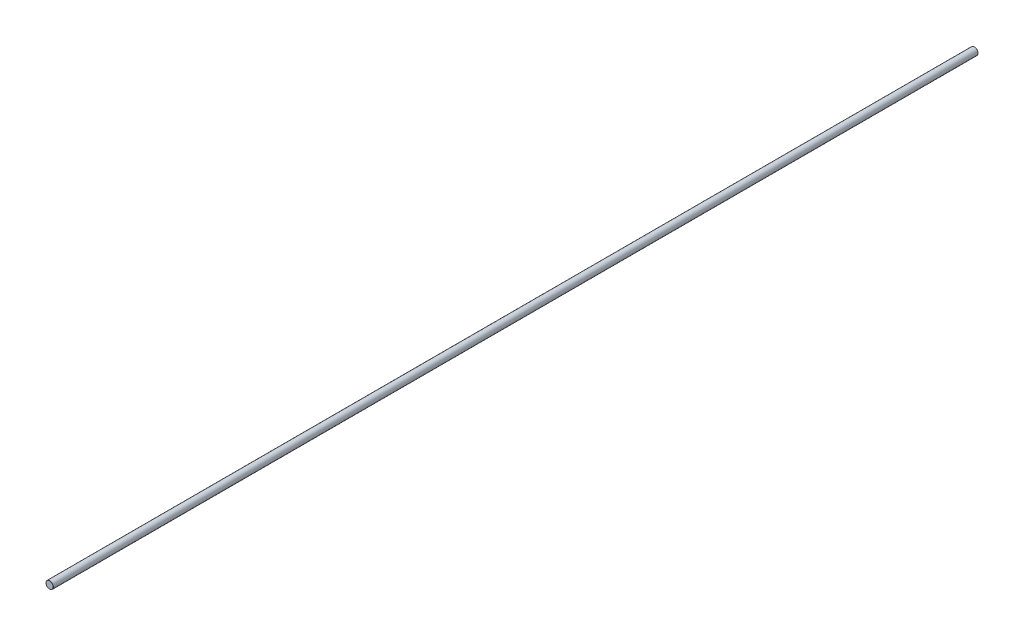
from build123d import *

# Parameters (mm, degrees)
BOSS_EXTRUDE1_DEPTH      = 750
BOSS_EXTRUDE1_DEPTH_BACK = 750
SKETCH3_R                = 6
CHAMFER1_SIZE            = 0.24
SKETCH5_R                = 0.04114626
CUT_EXTRUDE2_DEPTH       = 751.047998464


with BuildPart() as part:
    # Sketch3 → Boss-Extrude1 (new, two sides: drawn at the far end of the back side and taken through both)
    with BuildSketch(Plane.XY.offset(-BOSS_EXTRUDE1_DEPTH_BACK)):
        Circle(SKETCH3_R)
    extrude(amount=BOSS_EXTRUDE1_DEPTH + BOSS_EXTRUDE1_DEPTH_BACK)

    # Chamfer1
    chamfer1_edges = [part.edges().sort_by_distance(p)[0] for p in [
        (-6, 0, -750),
        (-6, 0, 750),
    ]]
    chamfer(chamfer1_edges, length=CHAMFER1_SIZE)

    # Sketch5 → Cut-Extrude2 (cut, through all)
    with BuildSketch(Plane(origin=(0, 0, 0), x_dir=(1, 0, 0), z_dir=(0, 1, 0))):
        with Locations(Location((0, 0, 0), (0, 0, 270))):
            Circle(SKETCH5_R)
    extrude(amount=-CUT_EXTRUDE2_DEPTH, mode=Mode.SUBTRACT)


solid = part.part
